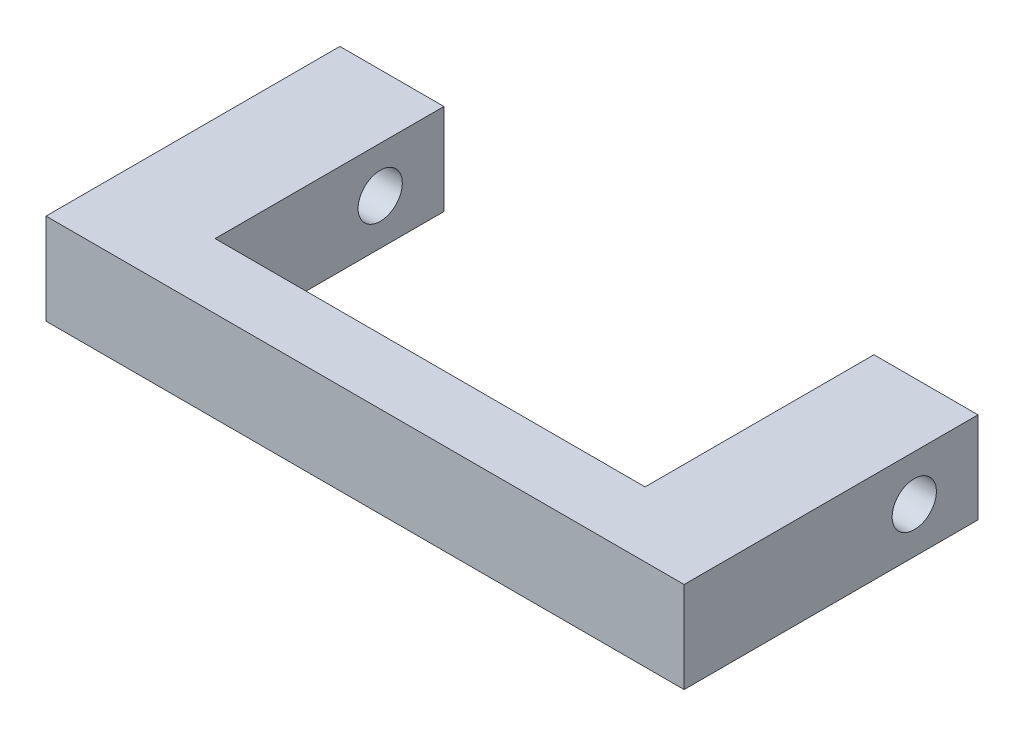
from build123d import *

# Parameters (mm, degrees)
BOSS_EXTRUDE1_DEPTH = 7
SKETCH3_R           = 1.7
CUT_EXTRUDE2_DEPTH  = 60


with BuildPart() as part:
    # Sketch1 → Boss-Extrude1 (new body)
    with BuildSketch(Plane(origin=(0, 0, 0), x_dir=(1, 0, 0), z_dir=(0, 1, 0))):
        Polygon((-87.25, -27.005178012), (-87.25, -44.605178012), (-54.181, -44.605178012), (-54.181, -27.005178012), (-46.181, -27.005178012), (-46.181, -49.605178012), (-64.006, -49.605178012), (-77.425, -49.605178012), (-95.25, -49.605178012), (-95.25, -27.005178012), align=None)
    extrude(amount=BOSS_EXTRUDE1_DEPTH)

    # Sketch3 → Cut-Extrude2 (cut)
    with BuildSketch(Plane(origin=(-46.181, 0, 0), x_dir=(0, 0, -1), z_dir=(1, 0, 0))):
        with Locations((-31.905178012, 3.5)):
            Circle(SKETCH3_R)
    extrude(amount=-CUT_EXTRUDE2_DEPTH, mode=Mode.SUBTRACT)


solid = part.part
